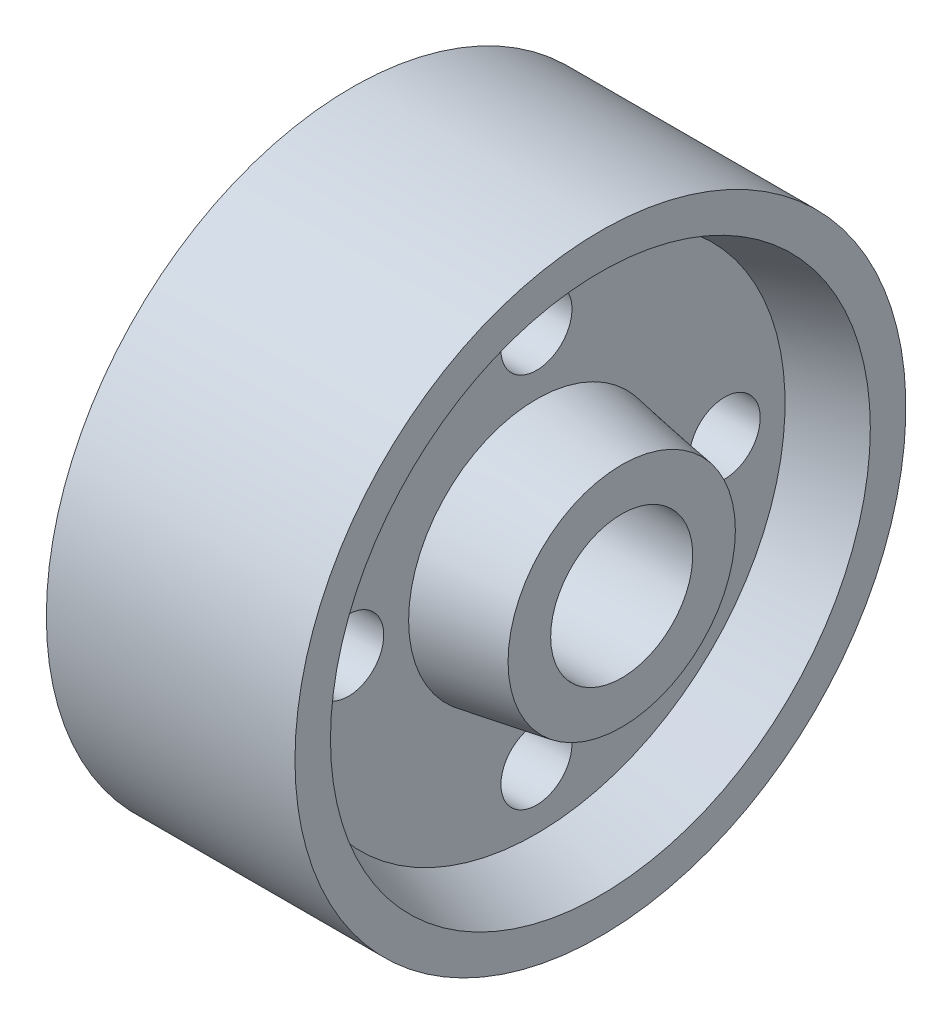
from build123d import *

# Parameters (mm, degrees)
SKETCH2_R          = 5
CUT_EXTRUDE1_DEPTH = 74.341666193
SKETCH3_R          = 10
CUT_EXTRUDE2_DEPTH = 74.341666193


with BuildPart() as part:
    # Sketch1 → Revolve2 (revolve)
    with BuildSketch(Plane(origin=(0, 0, 0), x_dir=(1, 0, 0), z_dir=(0, 1, 0)), mode=Mode.PRIVATE) as revolve2_sk:
        Polygon((0, 0), (0, 16), (12, 18), (12, 35), (3, 38), (3, 43), (38, 43), (38, 38), (29, 35), (29, 18), (41, 16), (41, 0), align=None)
    revolve(revolve2_sk.sketch.rotate(Axis((0, 0, 0), (1, 0, 0)), 180), axis=Axis((0, 0, 0), (1, 0, 0)))

    # Sketch2 → Cut-Extrude1 (cut, through all)
    with BuildSketch(Plane.ZY):
        with Locations((0, 26.5)):
            Circle(SKETCH2_R)
        with Locations((26.5, 0)):
            Circle(SKETCH2_R)
        with Locations((0, -26.5)):
            Circle(SKETCH2_R)
        with Locations((-26.5, 0)):
            Circle(SKETCH2_R)
    extrude(amount=-CUT_EXTRUDE1_DEPTH, mode=Mode.SUBTRACT)

    # Sketch3 → Cut-Extrude2 (cut, through all)
    with BuildSketch(Plane.ZY):
        Circle(SKETCH3_R)
    extrude(amount=-CUT_EXTRUDE2_DEPTH, mode=Mode.SUBTRACT)


solid = part.part
